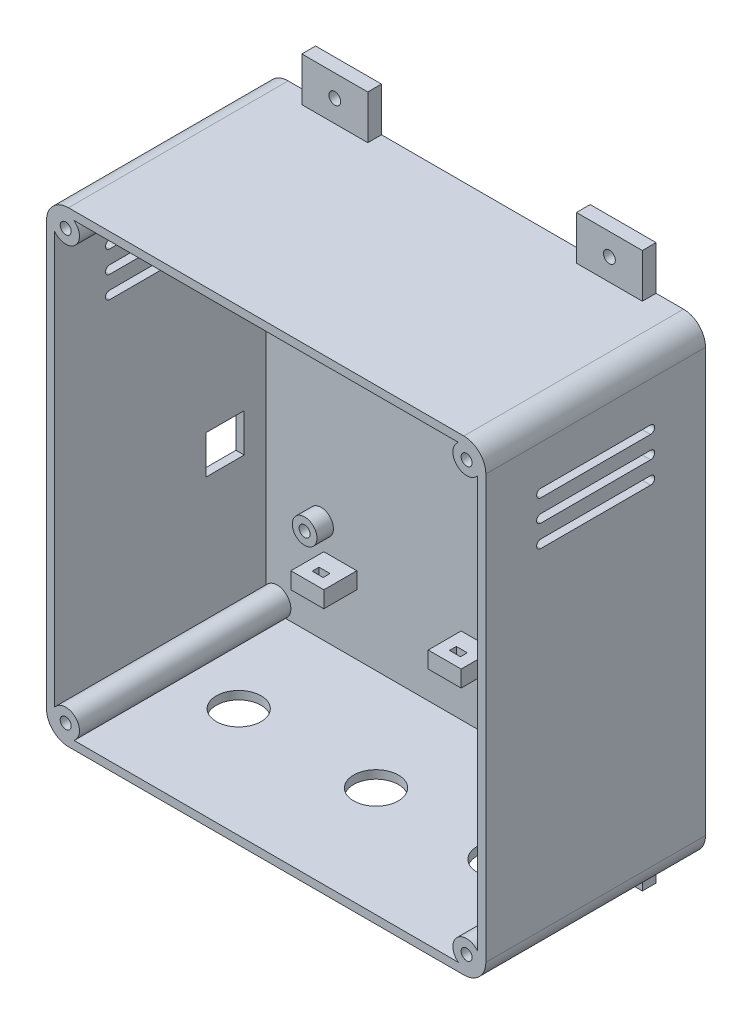
from build123d import *

# Parameters (mm, degrees)
BLOCK_DEPTH                    = 80
SHELL1_T                       = -3
SKETCH2_R                      = 5
CORNER_COLUMNS_DEPTH           = 80
SKETCH3_R                      = 2
FRONT_PANEL_INSERT_HOLES_DEPTH = 7
SKETCH4_R                      = 4.5
PLATE_BOSSES_DEPTH             = 6
SKETCH5_R                      = 2
PLATE_INSERT_HOLES_DEPTH       = 7
SKETCH6_R                      = 8.15
CABLE_GLAND_HOLES_DEPTH        = 4
SKETCH7_W                      = 12
SKETCH7_H                      = 6
CABLE_TIE_BARS_DEPTH           = 12
SKETCH8_W                      = 4
SKETCH8_H                      = 2.5
CABLE_TIE_SLOTS_DEPTH          = 6.02
SKETCH9_W                      = 14
SKETCH9_H                      = 14
USB_ACCESS_DEPTH               = 4
VENTS_LEFT_DEPTH               = 4
VENTS_START                    = -4
VENTS_RIGHT_DEPTH              = 4
SKETCH12_R                     = 4.75
KEYHOLE_HEADS_DEPTH            = 4
KEYHOLE_SLOTS_DEPTH            = 4
SKETCH14_W                     = 24
SKETCH14_H                     = 16
WALL_EARS_DEPTH                = 5
SKETCH15_R                     = 2.15
WALL_EAR_SCREW_HOLES_DEPTH     = 218.706224073


with BuildPart() as part:
    # Sketch1 → Block (new body)
    with BuildSketch(Plane.XY):
        with BuildLine():
            Line((-72, 0), (72, 0))
            ThreePointArc((72, 0), (77.656854249, 2.343145751), (80, 8))
            Line((80, 8), (80, 162))
            ThreePointArc((80, 162), (77.656854249, 167.656854249), (72, 170))
            Line((72, 170), (-72, 170))
            ThreePointArc((-72, 170), (-77.656854249, 167.656854249), (-80, 162))
            Line((-80, 162), (-80, 8))
            ThreePointArc((-80, 8), (-77.656854249, 2.343145751), (-72, 0))
        make_face()
    extrude(amount=BLOCK_DEPTH)

    # Shell1
    shell1_openings = [part.faces().sort_by_distance(p)[0] for p in [
        (0, 85, 80),
    ]]
    offset(amount=SHELL1_T, openings=shell1_openings, kind=Kind.INTERSECTION)

    # Sketch2 → Corner columns (add)
    with BuildSketch(Plane.XY):
        with Locations((-73, 7)):
            Circle(SKETCH2_R)
        with Locations((73, 7)):
            Circle(SKETCH2_R)
        with Locations((-73, 163)):
            Circle(SKETCH2_R)
        with Locations((73, 163)):
            Circle(SKETCH2_R)
    extrude(amount=CORNER_COLUMNS_DEPTH)

    # Sketch3 → Front panel insert holes (cut)
    with BuildSketch(Plane.XY.offset(80)):
        with Locations((-73, 7)):
            Circle(SKETCH3_R)
        with Locations((73, 7)):
            Circle(SKETCH3_R)
        with Locations((-73, 163)):
            Circle(SKETCH3_R)
        with Locations((73, 163)):
            Circle(SKETCH3_R)
    extrude(amount=-FRONT_PANEL_INSERT_HOLES_DEPTH, mode=Mode.SUBTRACT)

    # Sketch4 → Plate bosses (add)
    with BuildSketch(Plane.XY.offset(3)):
        with Locations((-57, 40)):
            Circle(SKETCH4_R)
        with Locations((57, 40)):
            Circle(SKETCH4_R)
        with Locations((-57, 150)):
            Circle(SKETCH4_R)
        with Locations((57, 150)):
            Circle(SKETCH4_R)
    extrude(amount=PLATE_BOSSES_DEPTH)

    # Sketch5 → Plate insert holes (cut)
    with BuildSketch(Plane.XY.offset(9)):
        with Locations((-57, 40)):
            Circle(SKETCH5_R)
        with Locations((57, 40)):
            Circle(SKETCH5_R)
        with Locations((-57, 150)):
            Circle(SKETCH5_R)
        with Locations((57, 150)):
            Circle(SKETCH5_R)
    extrude(amount=-PLATE_INSERT_HOLES_DEPTH, mode=Mode.SUBTRACT)

    # Sketch6 → Cable gland holes (cut)
    with BuildSketch(Plane(origin=(0, 0, 0), x_dir=(1, 0, 0), z_dir=(0, 1, 0))):
        with Locations(Location((-50, -40, 0), (0, 0, 270))):
            Circle(SKETCH6_R)
        with Locations(Location((0, -40, 0), (0, 0, 270))):
            Circle(SKETCH6_R)
        with Locations(Location((45, -40, 0), (0, 0, 270))):
            Circle(SKETCH6_R)
    extrude(amount=CABLE_GLAND_HOLES_DEPTH, mode=Mode.SUBTRACT)

    # Sketch7 → Cable tie bars (add)
    with BuildSketch(Plane.XY.offset(3)):
        with Locations((-50, 28)):
            Rectangle(SKETCH7_W, SKETCH7_H)
        with Locations((0, 28)):
            Rectangle(SKETCH7_W, SKETCH7_H)
        with Locations((45, 28)):
            Rectangle(SKETCH7_W, SKETCH7_H)
    extrude(amount=CABLE_TIE_BARS_DEPTH)

    # Sketch8 → Cable tie slots (cut)
    with BuildSketch(Plane(origin=(0, 24.99, 0), x_dir=(1, 0, 0), z_dir=(0, 1, 0))):
        with Locations((-50, -10)):
            Rectangle(SKETCH8_W, SKETCH8_H)
        with Locations((0, -10)):
            Rectangle(SKETCH8_W, SKETCH8_H)
        with Locations((45, -10)):
            Rectangle(SKETCH8_W, SKETCH8_H)
    extrude(amount=CABLE_TIE_SLOTS_DEPTH, mode=Mode.SUBTRACT)

    # Sketch9 → USB access (cut)
    with BuildSketch(Plane(origin=(-80, 0, 0), x_dir=(0, 0, -1), z_dir=(1, 0, 0))):
        with Locations((-18, 62)):
            Rectangle(SKETCH9_W, SKETCH9_H)
    extrude(amount=USB_ACCESS_DEPTH, mode=Mode.SUBTRACT)

    # Sketch10 → Vents left (cut)
    with BuildSketch(Plane(origin=(-80, 0, 0), x_dir=(0, 0, -1), z_dir=(1, 0, 0))):
        with BuildLine():
            Line((-20, 128.5), (-60, 128.5))
            ThreePointArc((-60, 128.5), (-61.5, 130), (-60, 131.5))
            Line((-60, 131.5), (-20, 131.5))
            ThreePointArc((-20, 131.5), (-18.5, 130), (-20, 128.5))
        make_face()
        with BuildLine():
            Line((-20, 136.5), (-60, 136.5))
            ThreePointArc((-60, 136.5), (-61.5, 138), (-60, 139.5))
            Line((-60, 139.5), (-20, 139.5))
            ThreePointArc((-20, 139.5), (-18.5, 138), (-20, 136.5))
        make_face()
        with BuildLine():
            Line((-20, 144.5), (-60, 144.5))
            ThreePointArc((-60, 144.5), (-61.5, 146), (-60, 147.5))
            Line((-60, 147.5), (-20, 147.5))
            ThreePointArc((-20, 147.5), (-18.5, 146), (-20, 144.5))
        make_face()
    extrude(amount=VENTS_LEFT_DEPTH, mode=Mode.SUBTRACT)

    # Sketch11 → Vents right (cut)
    with BuildSketch(Plane(origin=(80, 0, 0), x_dir=(0, 0, -1), z_dir=(1, 0, 0)).offset(VENTS_START)):
        with BuildLine():
            Line((-20, 128.5), (-60, 128.5))
            ThreePointArc((-60, 128.5), (-61.5, 130), (-60, 131.5))
            Line((-60, 131.5), (-20, 131.5))
            ThreePointArc((-20, 131.5), (-18.5, 130), (-20, 128.5))
        make_face()
        with BuildLine():
            Line((-20, 136.5), (-60, 136.5))
            ThreePointArc((-60, 136.5), (-61.5, 138), (-60, 139.5))
            Line((-60, 139.5), (-20, 139.5))
            ThreePointArc((-20, 139.5), (-18.5, 138), (-20, 136.5))
        make_face()
        with BuildLine():
            Line((-20, 144.5), (-60, 144.5))
            ThreePointArc((-60, 144.5), (-61.5, 146), (-60, 147.5))
            Line((-60, 147.5), (-20, 147.5))
            ThreePointArc((-20, 147.5), (-18.5, 146), (-20, 144.5))
        make_face()
    extrude(amount=VENTS_RIGHT_DEPTH, mode=Mode.SUBTRACT)

    # Sketch12 → Keyhole heads (cut)
    with BuildSketch(Plane.XY):
        with Locations((-40, 130)):
            Circle(SKETCH12_R)
        with Locations((40, 130)):
            Circle(SKETCH12_R)
    extrude(amount=KEYHOLE_HEADS_DEPTH, mode=Mode.SUBTRACT)

    # Sketch13 → Keyhole slots (cut)
    with BuildSketch(Plane.XY):
        with BuildLine():
            Line((-42.15, 130), (-42.15, 141))
            ThreePointArc((-42.15, 141), (-40, 143.15), (-37.85, 141))
            Line((-37.85, 141), (-37.85, 130))
            ThreePointArc((-37.85, 130), (-40, 127.85), (-42.15, 130))
        make_face()
        with BuildLine():
            Line((37.85, 130), (37.85, 141))
            ThreePointArc((37.85, 141), (40, 143.15), (42.15, 141))
            Line((42.15, 141), (42.15, 130))
            ThreePointArc((42.15, 130), (40, 127.85), (37.85, 130))
        make_face()
    extrude(amount=KEYHOLE_SLOTS_DEPTH, mode=Mode.SUBTRACT)

    # Sketch14 → Wall ears (add)
    with BuildSketch(Plane.XY):
        with Locations((-50, -8)):
            Rectangle(SKETCH14_W, SKETCH14_H)
        with Locations((-50, 178)):
            Rectangle(SKETCH14_W, SKETCH14_H)
        with Locations((50, -8)):
            Rectangle(SKETCH14_W, SKETCH14_H)
        with Locations((50, 178)):
            Rectangle(SKETCH14_W, SKETCH14_H)
    extrude(amount=WALL_EARS_DEPTH)

    # Sketch15 → Wall ear screw holes (cut, through all)
    with BuildSketch(Plane.XY):
        with Locations(Location((-50, -8, 0), (0, 0, 180))):
            Circle(SKETCH15_R)
        with Locations(Location((-50, 178, 0), (0, 0, 180))):
            Circle(SKETCH15_R)
        with Locations(Location((50, -8, 0), (0, 0, 180))):
            Circle(SKETCH15_R)
        with Locations(Location((50, 178, 0), (0, 0, 180))):
            Circle(SKETCH15_R)
    extrude(amount=WALL_EAR_SCREW_HOLES_DEPTH, mode=Mode.SUBTRACT)


solid = part.part
